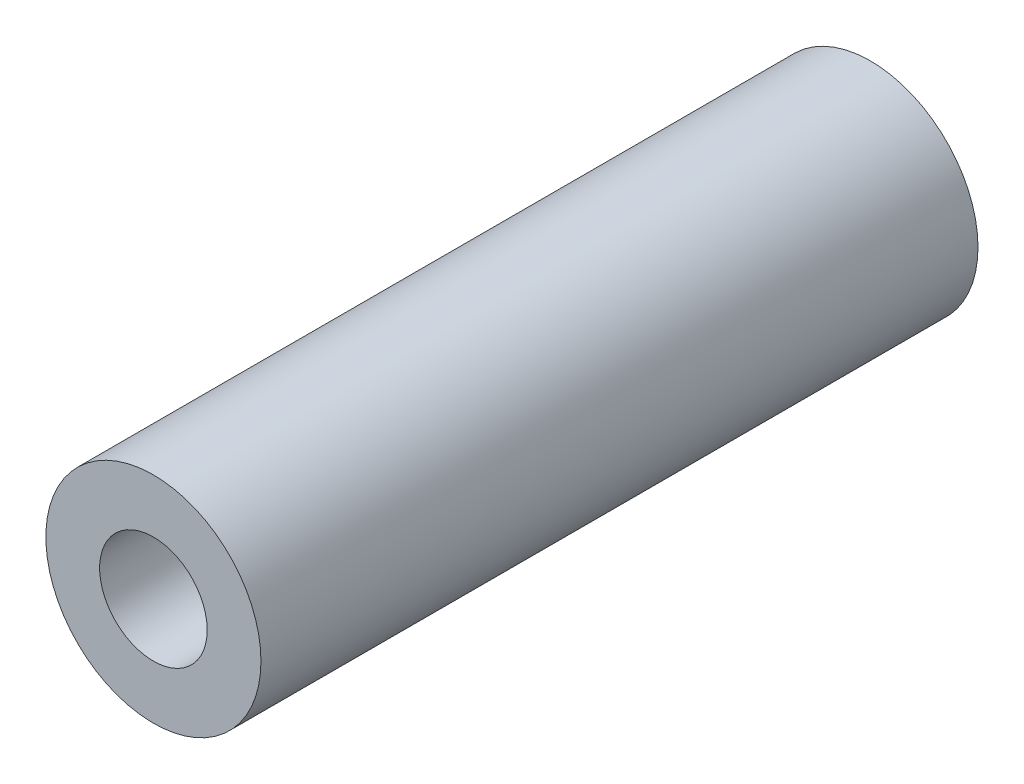
from build123d import *

# Parameters (mm, degrees)
SKETCH1_R           = 3
BOSS_EXTRUDE1_DEPTH = 20
SKETCH3_R           = 1.5
CUT_EXTRUDE1_DEPTH  = 21.4450483


with BuildPart() as part:
    # Sketch1 → Boss-Extrude1 (new body)
    with BuildSketch(Plane.XY):
        Circle(SKETCH1_R)
    extrude(amount=BOSS_EXTRUDE1_DEPTH)

    # Sketch3 → Cut-Extrude1 (cut, through all)
    with BuildSketch(Plane.XY.offset(20)):
        Circle(SKETCH3_R)
    extrude(amount=-CUT_EXTRUDE1_DEPTH, mode=Mode.SUBTRACT)


solid = part.part
